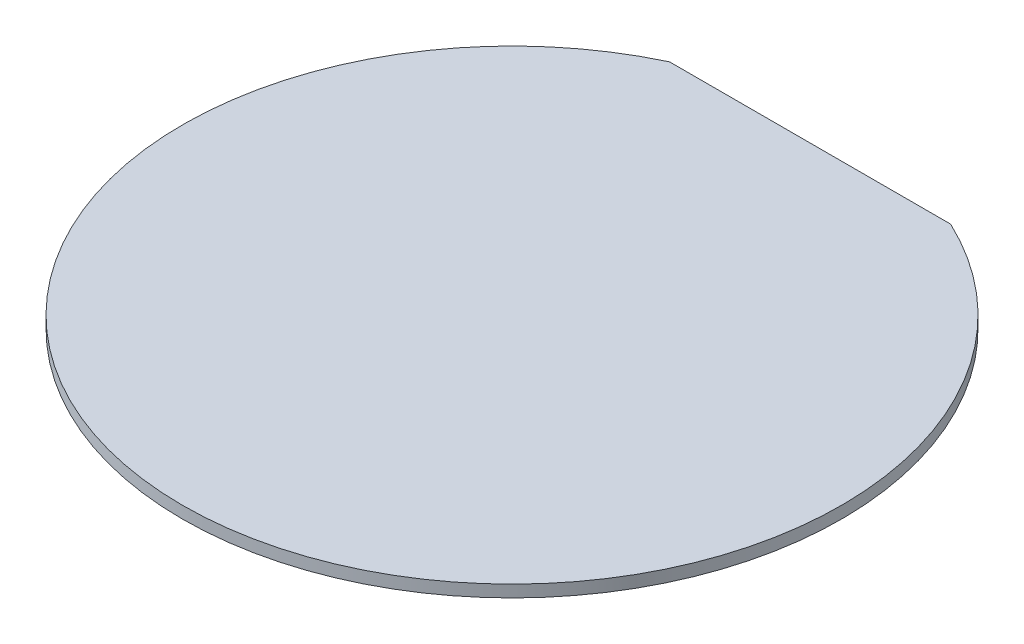
from build123d import *

# Parameters (mm, degrees)
BOSS_EXTRUDE1_DEPTH = 1


with BuildPart() as part:
    # Sketch1 → Boss-Extrude1 (new body)
    with BuildSketch(Plane(origin=(0, 0, 0), x_dir=(-1, 0, 0), z_dir=(0, 1, 0))):
        with BuildLine():
            Line((-21.405052785, -28.363690629), (2.054435731, -28.363690629))
            ThreePointArc((2.054435731, -28.363690629), (-9.675308527, 24.021882029), (-21.405052785, -28.363690629))
        make_face()
    extrude(amount=BOSS_EXTRUDE1_DEPTH)


solid = part.part
